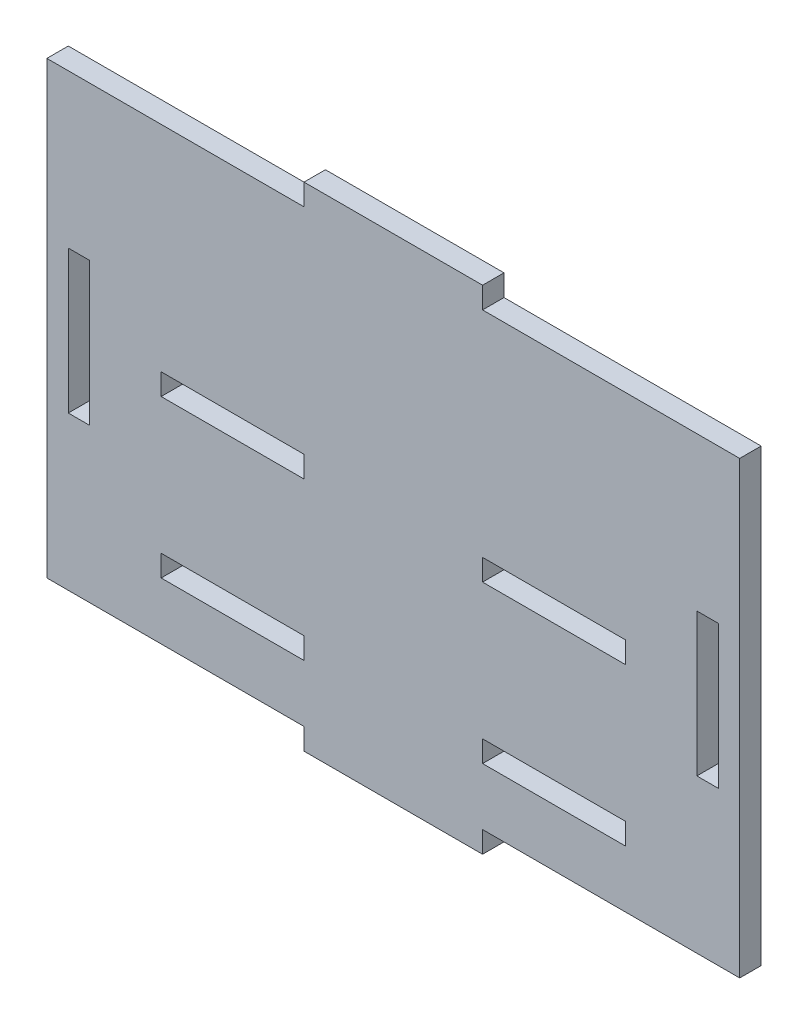
from build123d import *

# Parameters (mm, degrees)
SKETCH1_W           = 85
SKETCH1_H           = 63
BOSS_EXTRUDE1_DEPTH = 3
SKETCH2_W           = 20
SKETCH2_H           = 3
CUT_EXTRUDE1_DEPTH  = 53.985847167
BOSS_EXTRUDE2_DEPTH = 3
SKETCH4_W           = 25
SKETCH4_H           = 3
BOSS_EXTRUDE3_DEPTH = 3


with BuildPart() as part:
    # Sketch1 → Boss-Extrude1 (new body)
    with BuildSketch(Plane.XY):
        Rectangle(SKETCH1_W, SKETCH1_H)
    extrude(amount=BOSS_EXTRUDE1_DEPTH)

    # Sketch2 → Cut-Extrude1 (cut, through all)
    with BuildSketch(Plane.XY.offset(3)):
        with Locations((-22.5, 0)):
            Rectangle(SKETCH2_W, SKETCH2_H)
        with Locations((22.5, 0)):
            Rectangle(SKETCH2_W, SKETCH2_H)
        with Locations((-22.5, -22)):
            Rectangle(SKETCH2_W, SKETCH2_H)
        with Locations((22.5, -22)):
            Rectangle(SKETCH2_W, SKETCH2_H)
    extrude(amount=-CUT_EXTRUDE1_DEPTH, mode=Mode.SUBTRACT)

    # Sketch3 → Boss-Extrude2 (add)
    with BuildSketch(Plane.XY.offset(3)):
        Polygon((-42.5, 31.5), (-48.5, 31.5), (-48.5, -31.5), (-42.5, -31.5), (-42.5, -10), (-45.5, -10), (-45.5, 10), (-42.5, 10), align=None)
        Polygon((42.5, 10), (42.5, 31.5), (48.5, 31.5), (48.5, -31.5), (42.5, -31.5), (42.5, -10), (45.5, -10), (45.5, 10), align=None)
    extrude(amount=-BOSS_EXTRUDE2_DEPTH)

    # Sketch4 → Boss-Extrude3 (add)
    with BuildSketch(Plane.XY.offset(3)):
        with Locations((0, 33)):
            Rectangle(SKETCH4_W, SKETCH4_H)
        with Locations((0, -33)):
            Rectangle(SKETCH4_W, SKETCH4_H)
    extrude(amount=-BOSS_EXTRUDE3_DEPTH)


solid = part.part
